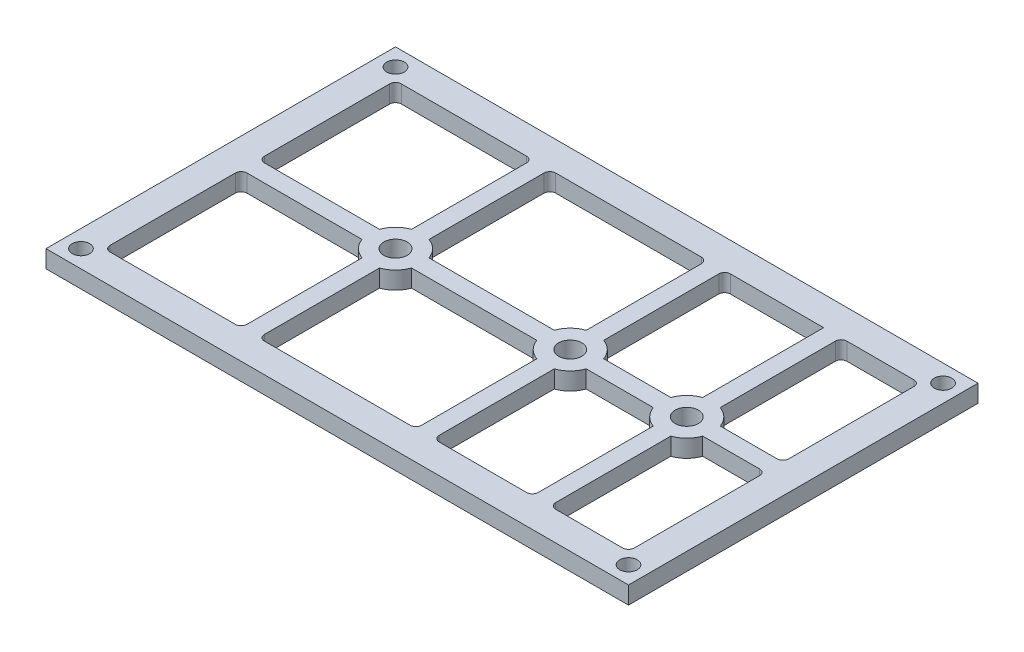
from build123d import *

# Parameters (mm, degrees)
SKETCH1_W           = 100
SKETCH1_H           = 60
BOSS_EXTRUDE1_DEPTH = 3
SKETCH2_R           = 2
SKETCH2_R_2         = 1.5
CUT_EXTRUDE1_DEPTH  = 59.386642308
FILLET1_R           = 1


with BuildPart() as part:
    # Sketch1 → Boss-Extrude1 (new body)
    with BuildSketch(Plane(origin=(0, 0, 0), x_dir=(1, 0, 0), z_dir=(0, 1, 0))):
        Rectangle(SKETCH1_W, SKETCH1_H)
    extrude(amount=BOSS_EXTRUDE1_DEPTH)

    # Sketch2 → Cut-Extrude1 (cut, through all)
    with BuildSketch(Plane(origin=(0, 3, 0), x_dir=(1, 0, 0), z_dir=(0, 1, 0))):
        with BuildLine():
            Line((-45, 1.5), (-24.242640687, 1.5))
            ThreePointArc((-24.242640687, 1.5), (-23.181980515, 3.181980515), (-21.5, 4.242640687))
            Line((-21.5, 4.242640687), (-21.5, 25))
            Line((-21.5, 25), (-45, 25))
            Line((-45, 25), (-45, 1.5))
        make_face()
        with BuildLine():
            Line((-45, -1.5), (-45, -25))
            Line((-45, -25), (-21.5, -25))
            Line((-21.5, -25), (-21.5, -4.242640687))
            ThreePointArc((-21.5, -4.242640687), (-23.181980515, -3.181980515), (-24.242640687, -1.5))
            Line((-24.242640687, -1.5), (-45, -1.5))
        make_face()
        with BuildLine():
            Line((-18.5, 25), (-18.5, 4.242640687))
            ThreePointArc((-18.5, 4.242640687), (-16.818019485, 3.181980515), (-15.757359313, 1.5))
            Line((-15.757359313, 1.5), (5.757359313, 1.5))
            ThreePointArc((5.757359313, 1.5), (6.818019485, 3.181980515), (8.5, 4.242640687))
            Line((8.5, 4.242640687), (8.5, 25))
            Line((8.5, 25), (-18.5, 25))
        make_face()
        with BuildLine():
            ThreePointArc((-15.757359313, -1.5), (-16.818019485, -3.181980515), (-18.5, -4.242640687))
            Line((-18.5, -4.242640687), (-18.5, -25))
            Line((-18.5, -25), (8.5, -25))
            Line((8.5, -25), (8.5, -4.242640687))
            ThreePointArc((8.5, -4.242640687), (6.818019485, -3.181980515), (5.757359313, -1.5))
            Line((5.757359313, -1.5), (-15.757359313, -1.5))
        make_face()
        with BuildLine():
            ThreePointArc((14.242640687, -1.5), (13.181980515, -3.181980515), (11.5, -4.242640687))
            Line((11.5, -4.242640687), (11.5, -25))
            Line((11.5, -25), (28.5, -25))
            Line((28.5, -25), (28.5, -4.242640687))
            ThreePointArc((28.5, -4.242640687), (26.818019485, -3.181980515), (25.757359313, -1.5))
            Line((25.757359313, -1.5), (14.242640687, -1.5))
        make_face()
        with BuildLine():
            Line((11.5, 25), (11.5, 4.242640687))
            ThreePointArc((11.5, 4.242640687), (13.181980515, 3.181980515), (14.242640687, 1.5))
            Line((14.242640687, 1.5), (25.757359313, 1.5))
            ThreePointArc((25.757359313, 1.5), (26.818019485, 3.181980515), (28.5, 4.242640687))
            Line((28.5, 4.242640687), (28.5, 25))
            Line((28.5, 25), (11.5, 25))
        make_face()
        with BuildLine():
            Line((31.5, 25), (31.5, 4.242640687))
            ThreePointArc((31.5, 4.242640687), (33.181980515, 3.181980515), (34.242640687, 1.5))
            Line((34.242640687, 1.5), (45, 1.5))
            Line((45, 1.5), (45, 25))
            Line((45, 25), (31.5, 25))
        make_face()
        with BuildLine():
            ThreePointArc((34.242640687, -1.5), (33.181980515, -3.181980515), (31.5, -4.242640687))
            Line((31.5, -4.242640687), (31.5, -25))
            Line((31.5, -25), (45, -25))
            Line((45, -25), (45, -1.5))
            Line((45, -1.5), (34.242640687, -1.5))
        make_face()
        with Locations(Location((30, 0, 0), (0, 0, 270))):
            Circle(SKETCH2_R)
        with Locations(Location((10, 0, 0), (0, 0, 270))):
            Circle(SKETCH2_R)
        with Locations(Location((-20, 0, 0), (0, 0, 270))):
            Circle(SKETCH2_R)
        with Locations(Location((-47, -27, 0), (0, 0, 270))):
            Circle(SKETCH2_R_2)
        with Locations(Location((-47, 27, 0), (0, 0, 270))):
            Circle(SKETCH2_R_2)
        with Locations(Location((47, -27, 0), (0, 0, 270))):
            Circle(SKETCH2_R_2)
        with Locations(Location((47, 27, 0), (0, 0, 270))):
            Circle(SKETCH2_R_2)
    extrude(amount=-CUT_EXTRUDE1_DEPTH, mode=Mode.SUBTRACT)

    # Fillet1
    fillet1_edges = [part.edges().sort_by_distance(p)[0] for p in [
        (8.5, 1.5, 25),
        (-18.5, 1.5, 25),
        (28.5, 1.5, 25),
        (11.5, 1.5, 25),
        (-45, 1.5, -1.5),
        (-45, 1.5, -25),
        (-21.5, 1.5, -25),
        (11.5, 1.5, -25),
        (31.5, 1.5, -25),
        (45, 1.5, -25),
        (45, 1.5, -1.5),
        (45, 1.5, 1.5),
        (45, 1.5, 25),
        (31.5, 1.5, 25),
        (-21.5, 1.5, 25),
        (-45, 1.5, 25),
        (-45, 1.5, 1.5),
        (-18.5, 1.5, -25),
        (8.5, 1.5, -25),
    ]]
    fillet(fillet1_edges, radius=FILLET1_R)


solid = part.part
